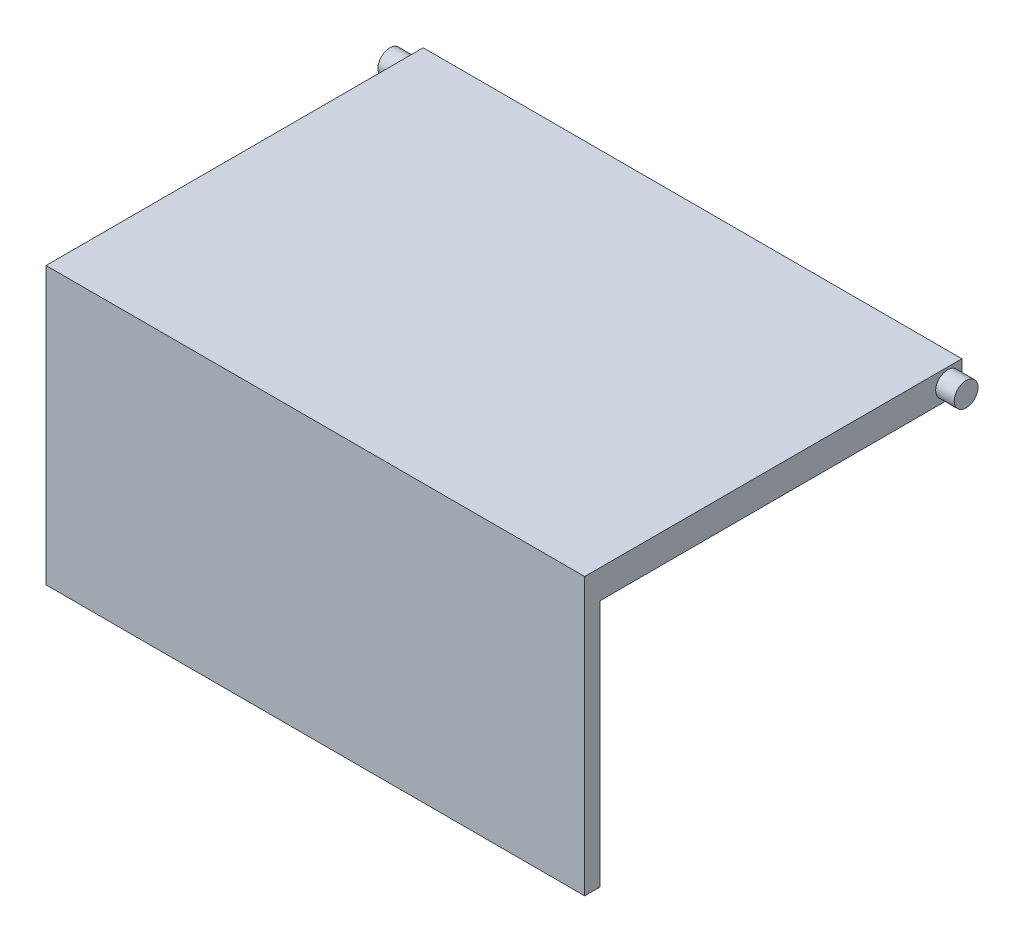
from build123d import *

# Parameters (mm, degrees)
SKETCH1_W                = 113.11
SKETCH1_H                = 5
BOSS_EXTRUDE1_DEPTH      = 80
SKETCH2_W                = 113.11
SKETCH2_H                = 4
BOSS_EXTRUDE3_DEPTH      = 53.07
BOSS_EXTRUDE4_DEPTH      = 4
BOSS_EXTRUDE4_DEPTH_BACK = 117
SKETCH3_R                = 2.5
SKETCH4_W                = 113.11
SKETCH4_H                = 1.014466344
BOSS_EXTRUDE5_DEPTH      = 79
SKETCH5_W                = 0.8
SKETCH5_H                = 62.100076999
CUT_EXTRUDE2_DEPTH       = 224


with BuildPart() as part:
    # Sketch1 → Boss-Extrude1 (new body)
    with BuildSketch(Plane.XY):
        with Locations((34.185736393, 6.080576307)):
            Rectangle(SKETCH1_W, SKETCH1_H)
    extrude(amount=BOSS_EXTRUDE1_DEPTH)

    # Sketch2 → Boss-Extrude3 (add)
    with BuildSketch(Plane.XZ.offset(-3.580576307)):
        with Locations((34.185736393, 78)):
            Rectangle(SKETCH2_W, SKETCH2_H)
    extrude(amount=BOSS_EXTRUDE3_DEPTH)

    # Sketch3 → Boss-Extrude4 (add, two sides: drawn at the far end of the back side and taken through both)
    with BuildSketch(Plane.ZY.offset(22.369263607).offset(-BOSS_EXTRUDE4_DEPTH_BACK)):
        with Locations((3, 5.580576307)):
            Circle(SKETCH3_R)
    extrude(amount=BOSS_EXTRUDE4_DEPTH + BOSS_EXTRUDE4_DEPTH_BACK)

    # Sketch4 → Boss-Extrude5 (add)
    with BuildSketch(Plane(origin=(0, 0, 0), x_dir=(-1, 0, 0), z_dir=(0, 0, -1))):
        with Locations((-34.185736393, 3.073343135)):
            Rectangle(SKETCH4_W, SKETCH4_H)
    extrude(amount=-BOSS_EXTRUDE5_DEPTH)

    # Sketch5 → Cut-Extrude2 (cut)
    with BuildSketch(Plane.ZY.offset(22.369263607)):
        with Locations((79.6, -22.469462192)):
            Rectangle(SKETCH5_W, SKETCH5_H)
    extrude(amount=-CUT_EXTRUDE2_DEPTH, mode=Mode.SUBTRACT)


solid = part.part
